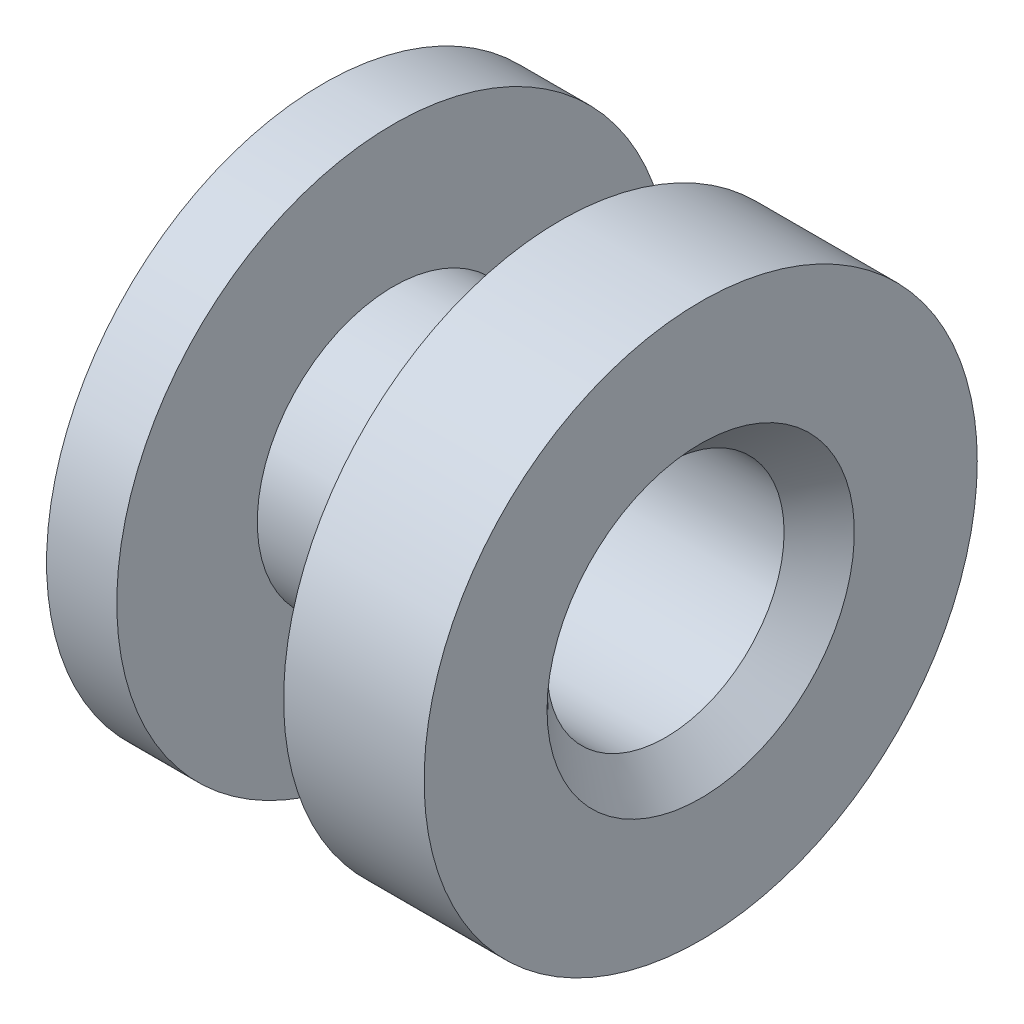
from build123d import *

# Parameters (mm, degrees)
CUT_EXTRUDE1_DEPTH      = 16.726477228
CUT_EXTRUDE1_DEPTH_BACK = 16.726477228
SKETCH3_R               = 3.429
CHAMFER1_SIZE           = 1.016


with BuildPart() as part:
    # Sketch2 → Revolve1 (revolve)
    with BuildSketch(Plane.XY, mode=Mode.PRIVATE) as revolve1_sk:
        Polygon((10.922, 0), (0, 0), (0, 8.001), (2.032, 8.001), (2.032, 3.937), (6.858, 3.937), (6.858, 8.001), (10.922, 8.001), align=None)
    revolve(revolve1_sk.sketch.rotate(Axis((10.922, 0, 0), (-1, 0, 0)), 90), axis=Axis((10.922, 0, 0), (-1, 0, 0)))

    # Sketch3 → Cut-Extrude1 (cut, two sides: drawn at the far end of the back side and taken through both)
    with BuildSketch(Plane(origin=(10.922, 0, 0), x_dir=(0, 0, -1), z_dir=(1, 0, 0)).offset(-CUT_EXTRUDE1_DEPTH_BACK)):
        Circle(SKETCH3_R)
    extrude(amount=CUT_EXTRUDE1_DEPTH + CUT_EXTRUDE1_DEPTH_BACK, mode=Mode.SUBTRACT)

    # Chamfer1
    chamfer1_edges = [part.edges().sort_by_distance(p)[0] for p in [
        (10.922, 0, 3.429),
    ]]
    chamfer(chamfer1_edges, length=CHAMFER1_SIZE)


solid = part.part
